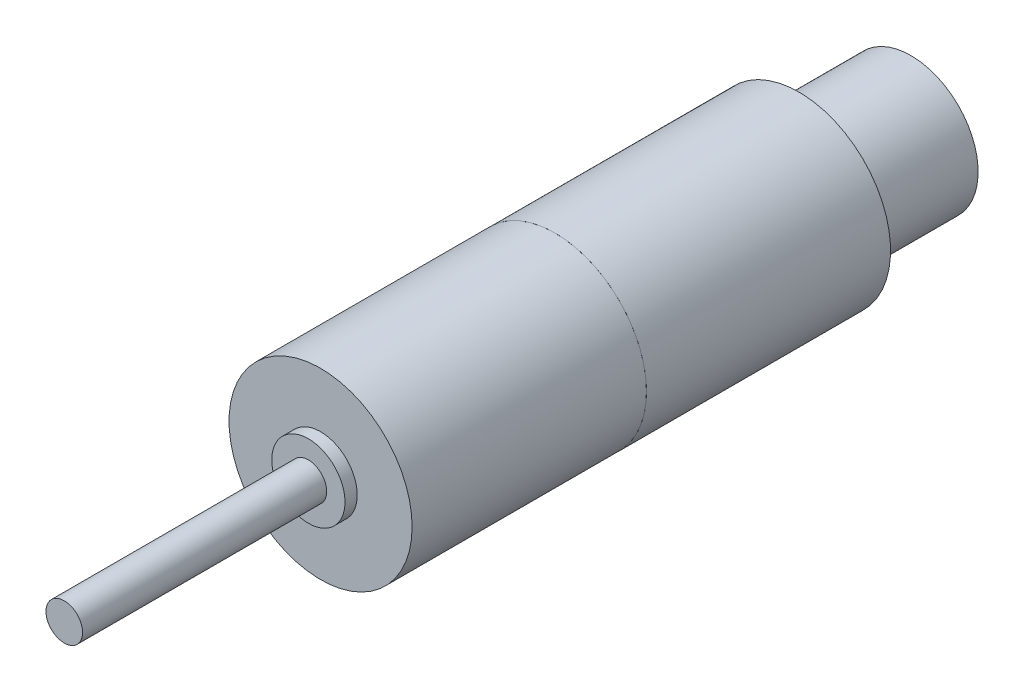
from build123d import *

# Parameters (mm, degrees)
SKETCH1_R           = 15
BOSS_EXTRUDE1_DEPTH = 38.4
SKETCH2_R           = 15
BOSS_EXTRUDE2_DEPTH = 40
SKETCH3_R           = 6
BOSS_EXTRUDE3_DEPTH = 2
SKETCH4_R           = 11
BOSS_EXTRUDE4_DEPTH = 18.35
SKETCH5_R           = 3
BOSS_EXTRUDE5_DEPTH = 40


with BuildPart() as part:
    # Sketch1 → Boss-Extrude1 (new body)
    with BuildSketch(Plane.XY):
        Circle(SKETCH1_R)
    extrude(amount=BOSS_EXTRUDE1_DEPTH)

    # Sketch3 → Boss-Extrude3 (add)
    with BuildSketch(Plane.XY.offset(38.4)):
        Circle(SKETCH3_R)
    extrude(amount=BOSS_EXTRUDE3_DEPTH)


with BuildPart() as body_2:
    # Sketch2 → Boss-Extrude2 (new body)
    with BuildSketch(Plane(origin=(0, 0, 0), x_dir=(-1, 0, 0), z_dir=(0, 0, -1))):
        Circle(SKETCH2_R)
    extrude(amount=BOSS_EXTRUDE2_DEPTH)


with BuildPart() as body_3:
    # Sketch4 → Boss-Extrude4 (new body)
    with BuildSketch(Plane(origin=(0, 0, -40), x_dir=(-1, 0, 0), z_dir=(0, 0, -1))):
        Circle(SKETCH4_R)
    extrude(amount=BOSS_EXTRUDE4_DEPTH)


with BuildPart() as body_4:
    # Sketch5 → Boss-Extrude5 (new body)
    with BuildSketch(Plane.XY.offset(40.4)):
        Circle(SKETCH5_R)
    extrude(amount=BOSS_EXTRUDE5_DEPTH)


solid = Compound([part.part, body_2.part, body_3.part, body_4.part])
